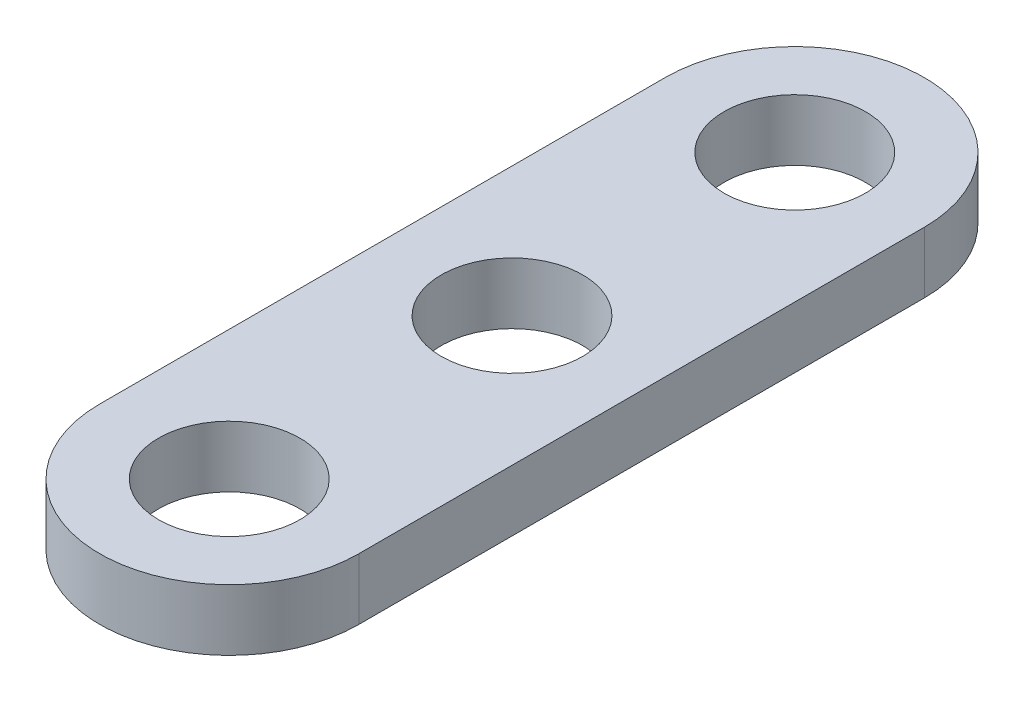
from build123d import *

# Parameters (mm, degrees)
SKETCH_1_R      = 3
EXTRUDE_1_DEPTH = 2.6


with BuildPart() as part:
    # 草图1 → 凸台-拉伸1 (new body)
    with BuildSketch(Plane(origin=(0, 0, 0), x_dir=(1, 0, 0), z_dir=(0, 1, 0))):
        with BuildLine():
            Line((-5.5, -12), (-5.5, 12))
            ThreePointArc((-5.5, 12), (0, 17.5), (5.5, 12))
            Line((5.5, 12), (5.5, -12))
            ThreePointArc((5.5, -12), (0, -17.5), (-5.5, -12))
        make_face()
        with Locations(Location((0, 0, 0), (0, 0, 270))):
            Circle(SKETCH_1_R, mode=Mode.SUBTRACT)
        with Locations(Location((0, 12, 0), (0, 0, 270))):
            Circle(SKETCH_1_R, mode=Mode.SUBTRACT)
        with Locations(Location((0, -12, 0), (0, 0, 270))):
            Circle(SKETCH_1_R, mode=Mode.SUBTRACT)
    extrude(amount=EXTRUDE_1_DEPTH)


solid = part.part
